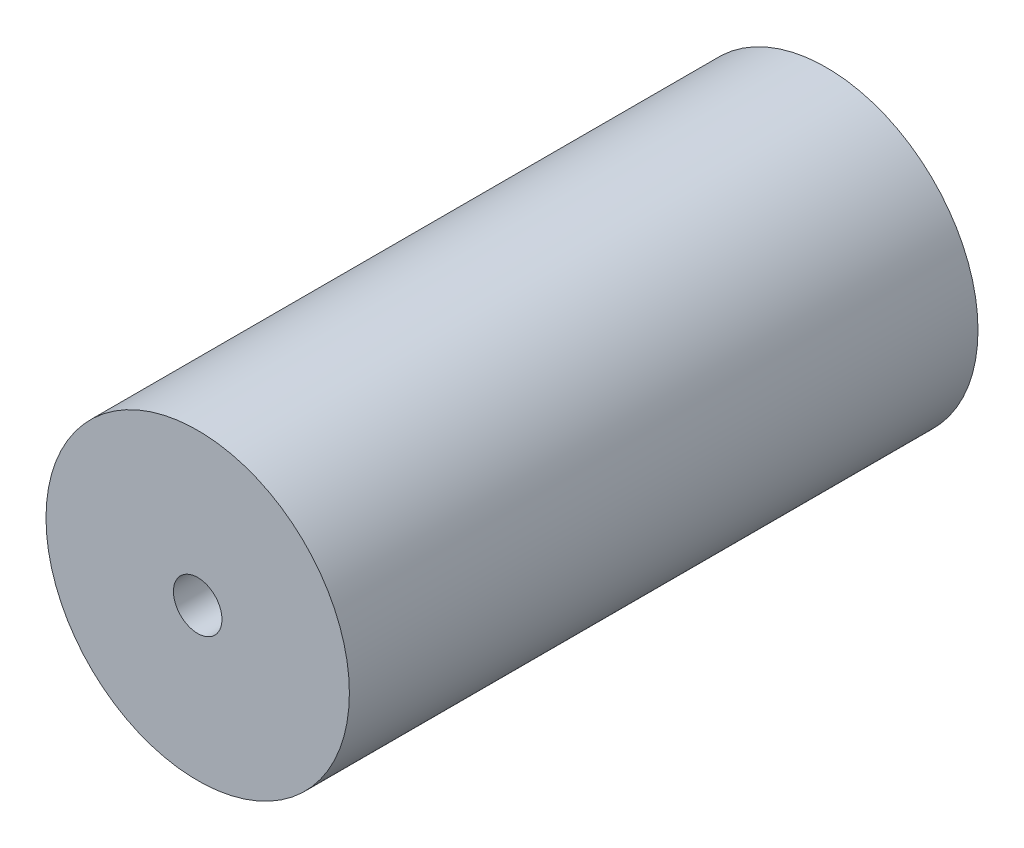
from build123d import *

# Parameters (mm, degrees)
SKETCH1_R           = 12.5
BOSS_EXTRUDE1_DEPTH = 51.8
SKETCH2_R           = 3.5
BOSS_EXTRUDE2_DEPTH = 2.38
SKETCH3_R           = 1.5
CUT_EXTRUDE1_DEPTH  = 5
SKETCH4_R           = 2
CUT_EXTRUDE2_DEPTH  = 57.990985252


with BuildPart() as part:
    # Sketch1 → Boss-Extrude1 (new body)
    with BuildSketch(Plane.XY):
        with Locations(Location((0, 0, 0), (0, 0, 180))):
            Circle(SKETCH1_R)
    extrude(amount=BOSS_EXTRUDE1_DEPTH)

    # Sketch2 → Boss-Extrude2 (add)
    with BuildSketch(Plane(origin=(0, 0, 0), x_dir=(-1, 0, 0), z_dir=(0, 0, -1))):
        Circle(SKETCH2_R)
    extrude(amount=BOSS_EXTRUDE2_DEPTH)

    # Sketch3 → Cut-Extrude1 (cut)
    with BuildSketch(Plane(origin=(0, 0, 0), x_dir=(-1, 0, 0), z_dir=(0, 0, -1))):
        with Locations((8.5, 0)):
            Circle(SKETCH3_R)
        with Locations((-8.5, 0)):
            Circle(SKETCH3_R)
    extrude(amount=-CUT_EXTRUDE1_DEPTH, mode=Mode.SUBTRACT)

    # Sketch4 → Cut-Extrude2 (cut, through all)
    with BuildSketch(Plane(origin=(0, 0, -2.38), x_dir=(-1, 0, 0), z_dir=(0, 0, -1))):
        Circle(SKETCH4_R)
    extrude(amount=-CUT_EXTRUDE2_DEPTH, mode=Mode.SUBTRACT)


solid = part.part
